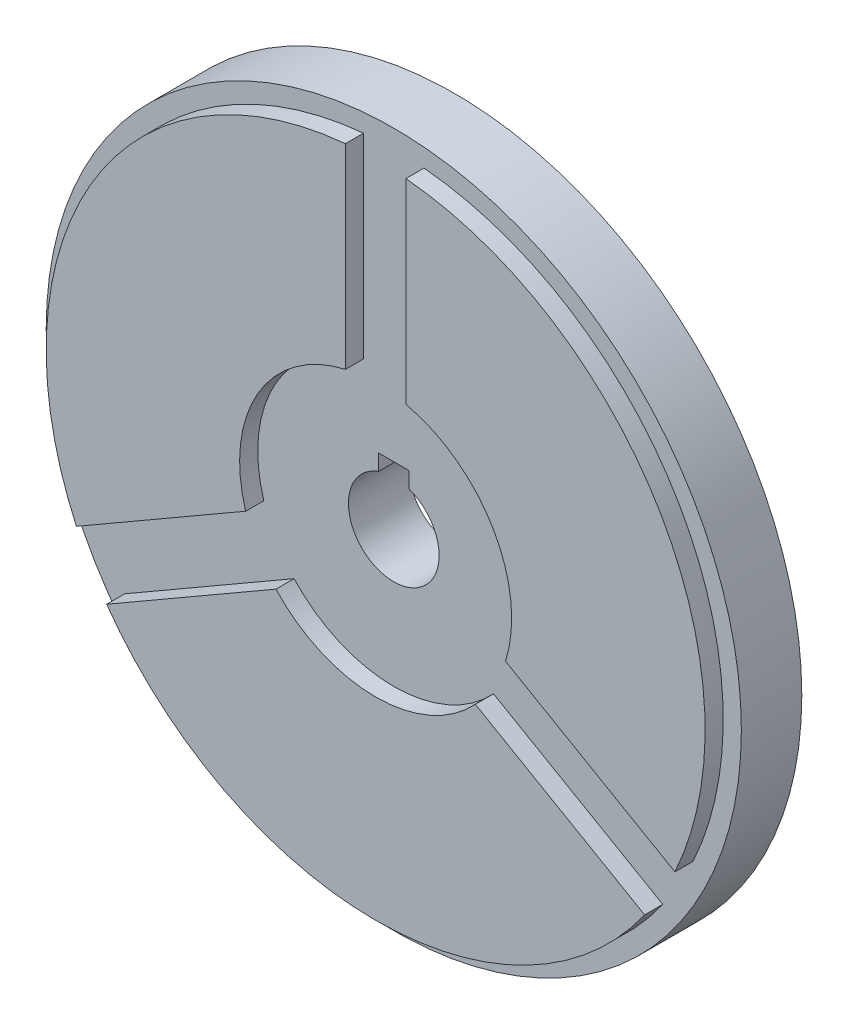
from build123d import *

# Parameters (mm, degrees)
ESBO_O1_R             = 57.5
ESBO_O1_R_2           = 7.5
EXTRUS_O1_DEPTH       = 10
EXTRUS_O2_DEPTH       = 3
ESBO_O3_W             = 5
ESBO_O3_H             = 9.7
CORTE_EXTRUS_O1_DEPTH = 82.929848041


with BuildPart() as part:
    # Esboço1 → Extrusão1 (new body)
    with BuildSketch(Plane.XY):
        Circle(ESBO_O1_R)
        Circle(ESBO_O1_R_2, mode=Mode.SUBTRACT)
    extrude(amount=-EXTRUS_O1_DEPTH)

    # Esboço2 → Extrusão2 (add)
    with BuildSketch(Plane.XY):
        with BuildLine():
            Line((5, 54.270157545), (5, 21.937410968))
            ThreePointArc((5, 21.937410968), (17.589059099, 14.0312152), (22.5, 0))
            ThreePointArc((22.5, 0), (22.248179609, -3.35685926), (21.498355192, -6.638578465))
            Line((21.498355192, -6.638578465), (49.499335102, -22.804951754))
            ThreePointArc((49.499335102, -22.804951754), (53.235156443, -11.673393615), (54.5, 0))
            ThreePointArc((54.5, 0), (40.266301047, 36.72703364), (5, 54.270157545))
        make_face()
        with BuildLine():
            ThreePointArc((-21.498355192, -6.638578465), (-19.485571585, 11.25), (-5, 21.937410968))
            Line((-5, 21.937410968), (-5, 54.270157545))
            ThreePointArc((-5, 54.270157545), (-47.198384506, 27.25), (-49.499335102, -22.804951754))
            Line((-49.499335102, -22.804951754), (-21.498355192, -6.638578465))
        make_face()
        with BuildLine():
            Line((44.499335102, -31.465205792), (16.498355192, -15.298832503))
            ThreePointArc((16.498355192, -15.298832503), (0, -22.5), (-16.498355192, -15.298832503))
            Line((-16.498355192, -15.298832503), (-44.499335102, -31.465205792))
            ThreePointArc((-44.499335102, -31.465205792), (0, -54.5), (44.499335102, -31.465205792))
        make_face()
    extrude(amount=EXTRUS_O2_DEPTH)

    # Esboço3 → Corte-extrusão1 (cut, through all)
    with BuildSketch(Plane.XY):
        with Locations((0, 4.85)):
            Rectangle(ESBO_O3_W, ESBO_O3_H)
    extrude(amount=-CORTE_EXTRUS_O1_DEPTH, mode=Mode.SUBTRACT)


solid = part.part
